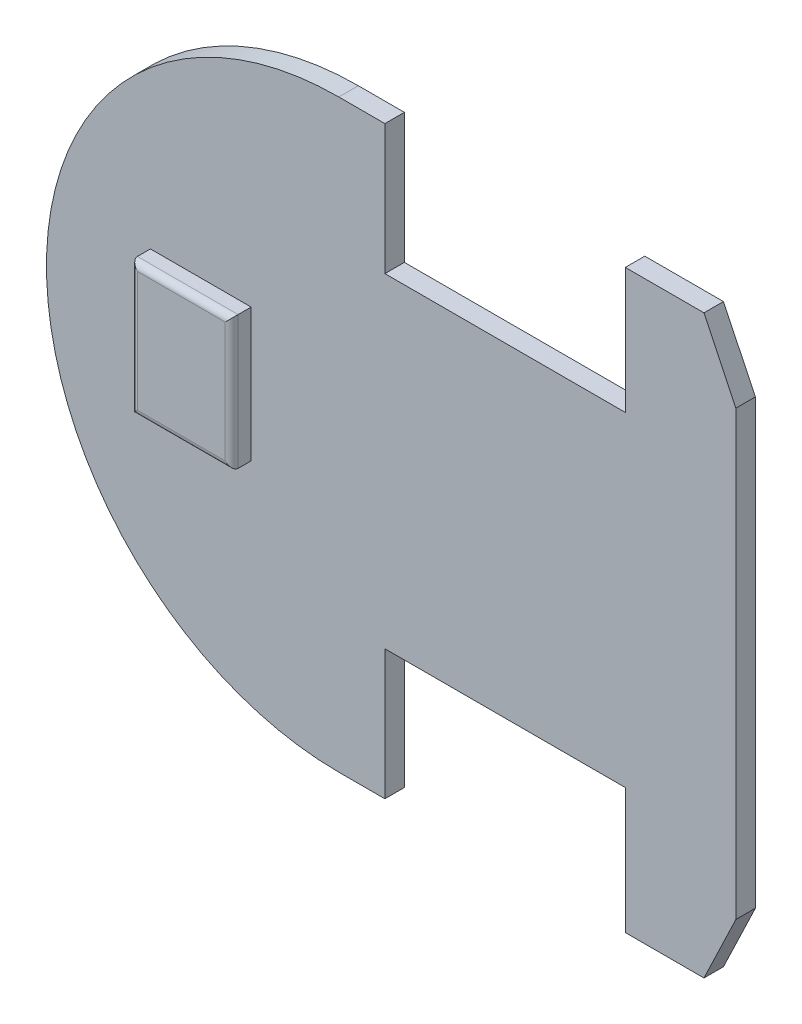
from build123d import *

# Parameters (mm, degrees)
SKETCH1_W           = 20.5
SKETCH1_H           = 15.5
BOSS_EXTRUDE1_DEPTH = 3
SKETCH1_10_W        = 20.5
SKETCH1_10_H        = 15.5
BOSS_EXTRUDE3_DEPTH = 6
SKETCH1_12_W        = 20.5
SKETCH1_12_H        = 15.5
CUT_EXTRUDE4_DEPTH  = 3
FILLET3_R           = 1


with BuildPart() as part:
    # Sketch1 → Boss-Extrude1 (new body)
    with BuildSketch(Plane(origin=(0, 0, 0), x_dir=(0, 1, 0), z_dir=(0, 0, 1))):
        with BuildLine():
            Line((-46.14933559, 23.035082174), (-26.14933559, 23.035082174))
            Line((-26.14933559, 23.035082174), (-26.14933559, -13.964917826))
            Line((-26.14933559, -13.964917826), (-45.480329832, -13.964917826))
            Line((-45.480329832, -13.964917826), (-45.480329832, -26.073683481))
            Line((-45.480329832, -26.073683481), (-35.226642372, -30.982423901))
            Line((-35.226642372, -30.982423901), (32.927971192, -30.982423901))
            Line((32.927971192, -30.982423901), (43.181658652, -26.073683481))
            Line((43.181658652, -26.073683481), (43.181658652, -13.964917826))
            Line((43.181658652, -13.964917826), (23.85066441, -13.964917826))
            Line((23.85066441, -13.964917826), (23.85066441, 23.035082174))
            Line((23.85066441, 23.035082174), (43.85066441, 23.035082174))
            Line((43.85066441, 23.035082174), (43.85066441, 30.122273759))
            ThreePointArc((43.85066441, 30.122273759), (-1.14933559, 75.122273759), (-46.14933559, 30.122273759))
            Line((-46.14933559, 30.122273759), (-46.14933559, 23.035082174))
        make_face()
        with Locations((-1.14933559, 51.372273759)):
            Rectangle(SKETCH1_W, SKETCH1_H, mode=Mode.SUBTRACT)
    extrude(amount=BOSS_EXTRUDE1_DEPTH)

    # Sketch1<10> → Boss-Extrude3 (add)
    with BuildSketch(Plane(origin=(0, 0, 0), x_dir=(0, 1, 0), z_dir=(0, 0, 1))):
        with Locations((-1.14933559, 51.372273759)):
            Rectangle(SKETCH1_10_W, SKETCH1_10_H)
    extrude(amount=BOSS_EXTRUDE3_DEPTH)

    # Sketch1<12> → Cut-Extrude4 (cut)
    with BuildSketch(Plane(origin=(0, 0, 0), x_dir=(0, 1, 0), z_dir=(0, 0, 1))):
        with Locations((-1.14933559, 51.372273759)):
            Rectangle(SKETCH1_12_W, SKETCH1_12_H)
    extrude(amount=CUT_EXTRUDE4_DEPTH, mode=Mode.SUBTRACT)


with BuildPart() as cut_extrude4_piece_1:
    # of the separate pieces the step leaves, piece 1, a body of its own (cut_extrude4_pieces)
    add(part.part.solids().sort_by_distance((-23.035082174, -46.14933559, 0))[0])


with BuildPart() as cut_extrude4_piece_2:
    # of the separate pieces the step leaves, piece 2, a body of its own (cut_extrude4_pieces)
    add(part.part.solids().sort_by_distance((-59.122273759, 9.10066441, 6))[0])

    # Fillet3
    fillet3_edges = [cut_extrude4_piece_2.edges().sort_by_distance(p)[0] for p in [
        (-59.122273759, -1.14933559, 6),
        (-51.372273759, 9.10066441, 6),
        (-43.622273759, -1.14933559, 6),
        (-51.372273759, -11.39933559, 6),
    ]]
    fillet(fillet3_edges, radius=FILLET3_R)


solid = Compound([cut_extrude4_piece_1.part, cut_extrude4_piece_2.part])
